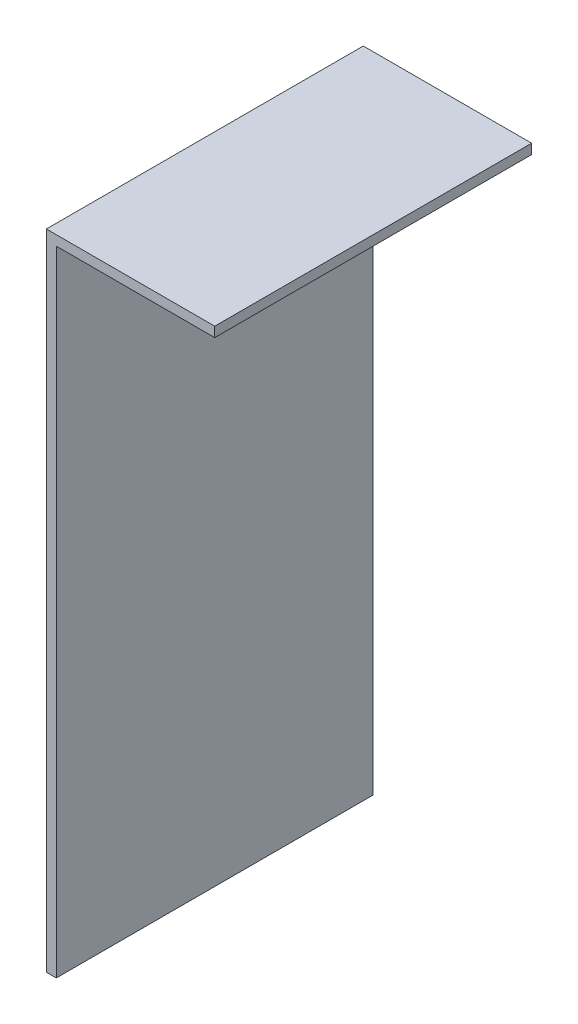
from build123d import *

# Parameters (mm, degrees)
BOSS_EXTRUDE1_DEPTH = 101.6


with BuildPart() as part:
    # Sketch1 → Boss-Extrude1 (new body)
    with BuildSketch(Plane.XY):
        Polygon((0, 206.375), (0, 0), (3.175, 0), (3.175, 203.2), (53.975, 203.2), (53.975, 206.375), align=None)
    extrude(amount=BOSS_EXTRUDE1_DEPTH)


solid = part.part
